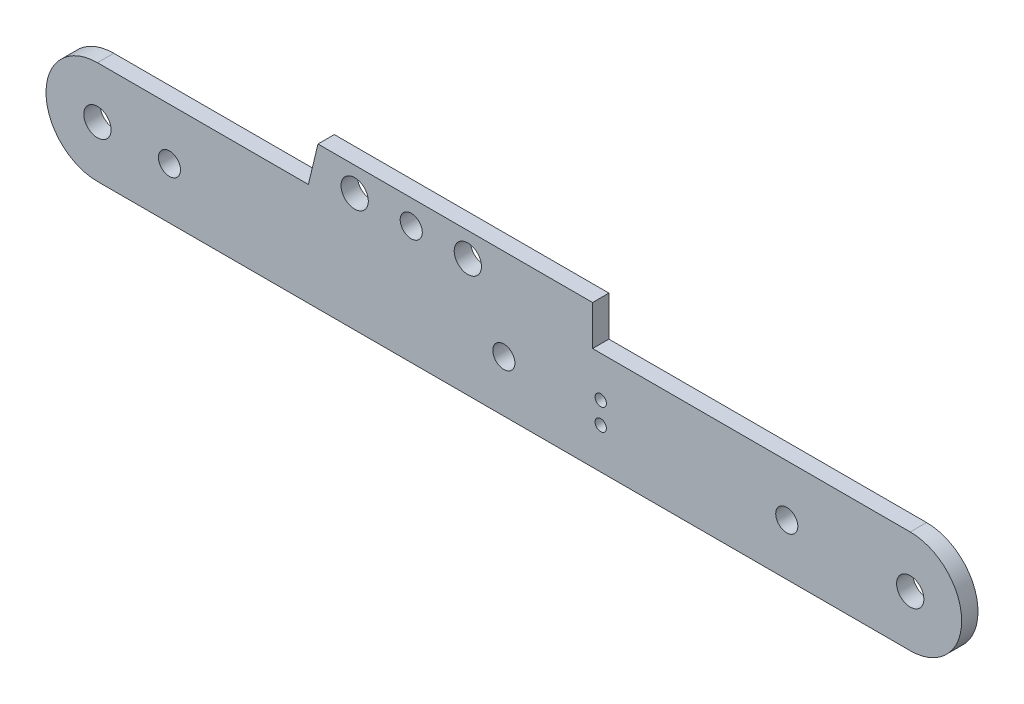
from build123d import *

# Parameters (mm, degrees)
BOSS_EXTRUDE1_DEPTH  = 3.175
M5_CLEARANCE_HOLE1_D = 5.3
BOSS_EXTRUDE2_DEPTH  = 3.175
M5_CLEARANCE_HOLE2_D = 5.3
M4_CLEARANCE_HOLE1_D = 4.3
M2_CLEARANCE_HOLE1_D = 2.2


with BuildPart() as part:
    # Sketch1 → Boss-Extrude1 (new body)
    with BuildSketch(Plane.XY):
        with BuildLine():
            Line((-79, 10), (79, 10))
            ThreePointArc((79, 10), (89, 0), (79, -10))
            Line((79, -10), (-79, -10))
            ThreePointArc((-79, -10), (-89, 0), (-79, 10))
        make_face()
    extrude(amount=BOSS_EXTRUDE1_DEPTH)

    # M5 Clearance Hole1 (through all)
    with Locations(Plane(origin=(0, 0, 0), x_dir=(-1, 0, 0), z_dir=(0, 0, -1))):
        with Locations((-79, 0), (79, 0)):
            Hole(M5_CLEARANCE_HOLE1_D / 2)

    # Sketch8 → Boss-Extrude2 (add)
    with BuildSketch(Plane(origin=(0, 0, 0), x_dir=(-1, 0, 0), z_dir=(0, 0, -1))):
        Polygon((38, 10), (36.129310345, 17.75), (-17.25, 17.75), (-17.25, 10), align=None)
    extrude(amount=-BOSS_EXTRUDE2_DEPTH)

    # M5 Clearance Hole2 (through all)
    with Locations(Plane(origin=(0, 0, 0), x_dir=(-1, 0, 0), z_dir=(0, 0, -1))):
        with Locations((7, 13), (29, 13)):
            Hole(M5_CLEARANCE_HOLE2_D / 2)

    # M4 Clearance Hole1 (through all)
    with Locations(Plane(origin=(0, 0, 0), x_dir=(-1, 0, 0), z_dir=(0, 0, -1))):
        with Locations((0, 0), (-55, 0), (18, 13), (65, 0)):
            Hole(M4_CLEARANCE_HOLE1_D / 2)

    # M2 Clearance Hole1 (through all)
    with Locations(Plane(origin=(0, 0, 0), x_dir=(-1, 0, 0), z_dir=(0, 0, -1))):
        with Locations((-18.8375, -2.1), (-18.8375, 2.1)):
            Hole(M2_CLEARANCE_HOLE1_D / 2)


solid = part.part
